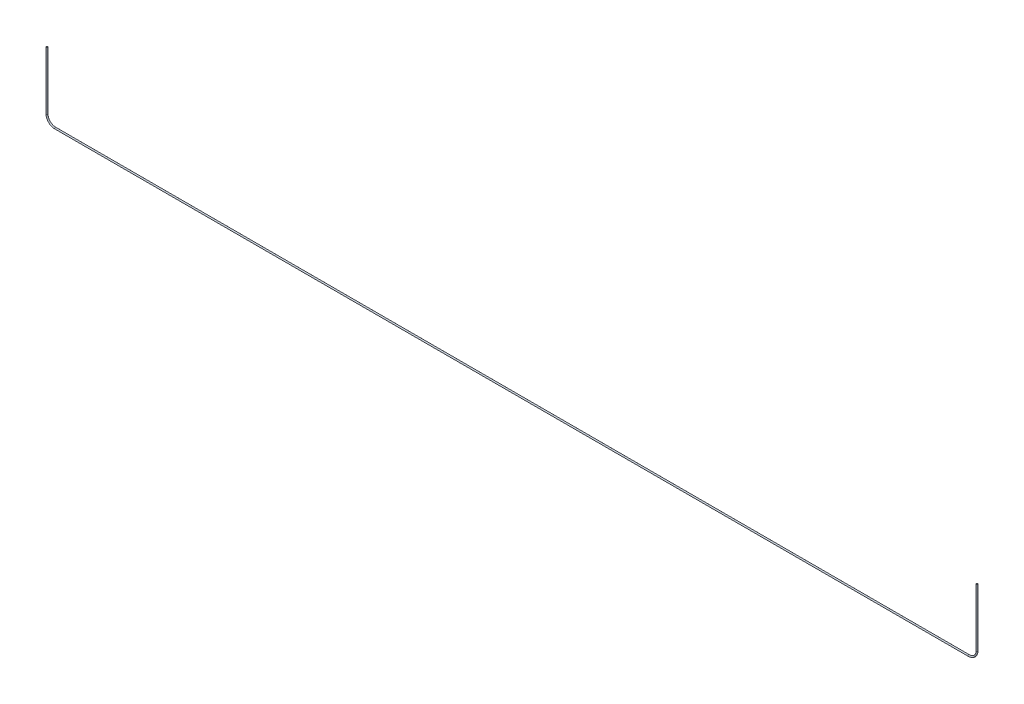
from build123d import *

# Parameters (mm, degrees)
SWEEP1_PROFILE_R = 6.35


with BuildPart() as part:
    # Sweep1: sweep along a path in Sketch1
    with BuildLine(Plane.XY) as sweep1_path:
        Line((-4220, 600), (-4220, 75))
        ThreePointArc((-4220, 75), (-4198.033008589, 21.966991411), (-4145, 0))
        Line((-4145, 0), (4145, 0))
        ThreePointArc((4145, 0), (4198.033008589, 21.966991411), (4220, 75))
        Line((4220, 75), (4220, 600))
    # Sweep1 profile (on start of the path) → Sweep1 (sweep)
    with BuildSketch(Plane(origin=(-4220, 600, 0), x_dir=(0, 0, -1), z_dir=(0, -1, 0))):
        Circle(SWEEP1_PROFILE_R)
    sweep(path=sweep1_path.line)


solid = part.part
